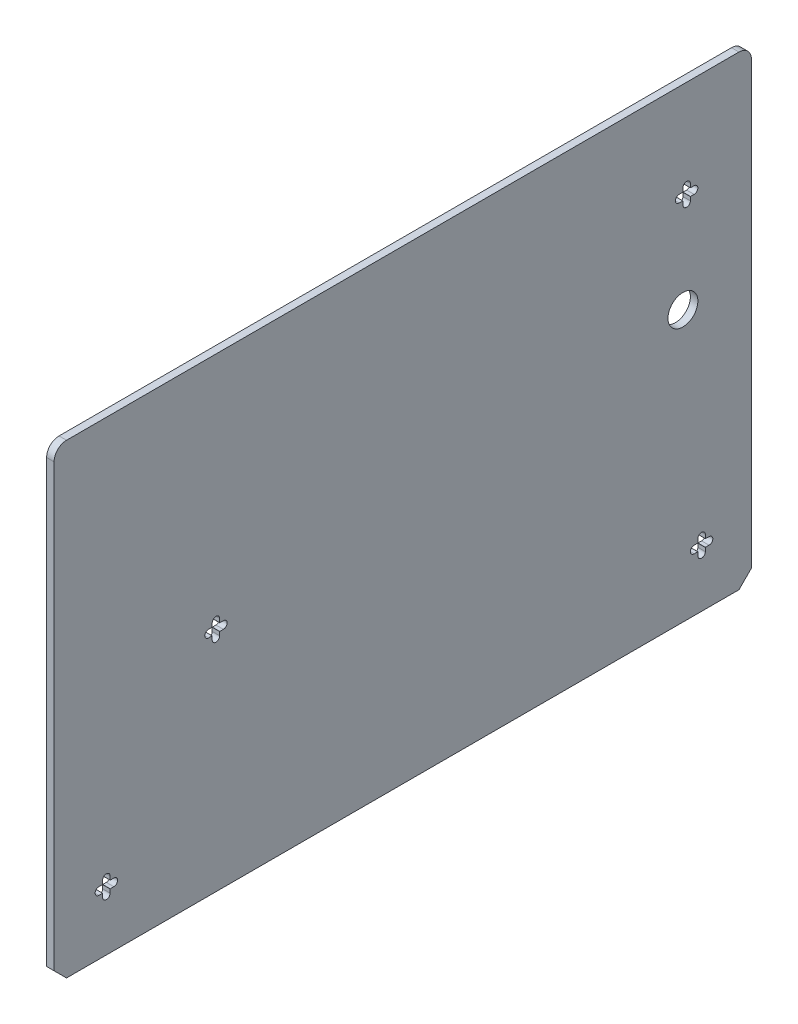
from build123d import *

# Parameters (mm, degrees)
SKETCH1_R           = 6
BOSS_EXTRUDE1_DEPTH = 3


with BuildPart() as part:
    # Sketch1 → Boss-Extrude1 (new body)
    with BuildSketch(Plane(origin=(0, 0, 0), x_dir=(0, -1, 0), z_dir=(1, 0, 0))):
        with BuildLine():
            Line((-93.5, 135), (-93.5, -135))
            ThreePointArc((-93.5, -135), (-92.035533906, -138.535533906), (-88.5, -140))
            Line((-88.5, -140), (88.5, -140))
            Line((88.5, -140), (93.5, -135))
            Line((93.5, -135), (93.5, 135))
            Line((93.5, 135), (88.5, 140))
            Line((88.5, 140), (-88.5, 140))
            ThreePointArc((-88.5, 140), (-92.035533906, 138.535533906), (-93.5, 135))
        make_face()
        with Locations(Location((-15.138013541, 112.5, 0), (0, 0, 90))):
            Circle(SKETCH1_R, mode=Mode.SUBTRACT)
        with BuildLine():
            Line((-52.95, 115.5), (-51.5, 115.5))
            ThreePointArc((-51.5, 115.5), (-50, 114), (-51.5, 112.5))
            Line((-51.5, 112.5), (-52.95, 112.5))
            ThreePointArc((-52.95, 112.5), (-52.985355339, 112.485355339), (-53, 112.45))
            Line((-53, 112.45), (-53, 111))
            ThreePointArc((-53, 111), (-54.5, 109.5), (-56, 111))
            Line((-56, 111), (-56, 112.45))
            ThreePointArc((-56, 112.45), (-56.014644661, 112.485355339), (-56.05, 112.5))
            Line((-56.05, 112.5), (-57.5, 112.5))
            ThreePointArc((-57.5, 112.5), (-59, 114), (-57.5, 115.5))
            Line((-57.5, 115.5), (-56.05, 115.5))
            ThreePointArc((-56.05, 115.5), (-56.014644661, 115.514644661), (-56, 115.55))
            Line((-56, 115.55), (-56, 117))
            ThreePointArc((-56, 117), (-54.5, 118.5), (-53, 117))
            Line((-53, 117), (-53, 115.55))
            ThreePointArc((-53, 115.55), (-52.985355339, 115.514644661), (-52.95, 115.5))
        make_face(mode=Mode.SUBTRACT)
        with BuildLine():
            Line((67.5, 121.5), (68.95, 121.5))
            ThreePointArc((68.95, 121.5), (68.985355339, 121.514644661), (69, 121.55))
            Line((69, 121.55), (69, 123))
            ThreePointArc((69, 123), (70.5, 124.5), (72, 123))
            Line((72, 123), (72, 121.55))
            ThreePointArc((72, 121.55), (72.014644661, 121.514644661), (72.05, 121.5))
            Line((72.05, 121.5), (73.5, 121.5))
            ThreePointArc((73.5, 121.5), (75, 120), (73.5, 118.5))
            Line((73.5, 118.5), (72.05, 118.5))
            ThreePointArc((72.05, 118.5), (72.014644661, 118.485355339), (72, 118.45))
            Line((72, 118.45), (72, 117))
            ThreePointArc((72, 117), (70.5, 115.5), (69, 117))
            Line((69, 117), (69, 118.45))
            ThreePointArc((69, 118.45), (68.985355339, 118.485355339), (68.95, 118.5))
            Line((68.95, 118.5), (67.5, 118.5))
            ThreePointArc((67.5, 118.5), (66, 120), (67.5, 121.5))
        make_face(mode=Mode.SUBTRACT)
        with BuildLine():
            Line((3.75, -72), (3.75, -73.45))
            ThreePointArc((3.75, -73.45), (3.764644661, -73.485355339), (3.8, -73.5))
            Line((3.8, -73.5), (5.25, -73.5))
            ThreePointArc((5.25, -73.5), (6.75, -75), (5.25, -76.5))
            Line((5.25, -76.5), (3.8, -76.5))
            ThreePointArc((3.8, -76.5), (3.764644661, -76.514644661), (3.75, -76.55))
            Line((3.75, -76.55), (3.75, -78))
            ThreePointArc((3.75, -78), (2.25, -79.5), (0.75, -78))
            Line((0.75, -78), (0.75, -76.55))
            ThreePointArc((0.75, -76.55), (0.735355339, -76.514644661), (0.7, -76.5))
            Line((0.7, -76.5), (-0.75, -76.5))
            ThreePointArc((-0.75, -76.5), (-2.25, -75), (-0.75, -73.5))
            Line((-0.75, -73.5), (0.7, -73.5))
            ThreePointArc((0.7, -73.5), (0.735355339, -73.485355339), (0.75, -73.45))
            Line((0.75, -73.45), (0.75, -72))
            ThreePointArc((0.75, -72), (2.25, -70.5), (3.75, -72))
        make_face(mode=Mode.SUBTRACT)
        with BuildLine():
            Line((71.25, -116), (71.25, -117.45))
            ThreePointArc((71.25, -117.45), (71.264644661, -117.485355339), (71.3, -117.5))
            Line((71.3, -117.5), (72.75, -117.5))
            ThreePointArc((72.75, -117.5), (74.25, -119), (72.75, -120.5))
            Line((72.75, -120.5), (71.3, -120.5))
            ThreePointArc((71.3, -120.5), (71.264644661, -120.514644661), (71.25, -120.55))
            Line((71.25, -120.55), (71.25, -122))
            ThreePointArc((71.25, -122), (69.75, -123.5), (68.25, -122))
            Line((68.25, -122), (68.25, -120.55))
            ThreePointArc((68.25, -120.55), (68.235355339, -120.514644661), (68.2, -120.5))
            Line((68.2, -120.5), (66.75, -120.5))
            ThreePointArc((66.75, -120.5), (65.25, -119), (66.75, -117.5))
            Line((66.75, -117.5), (68.2, -117.5))
            ThreePointArc((68.2, -117.5), (68.235355339, -117.485355339), (68.25, -117.45))
            Line((68.25, -117.45), (68.25, -116))
            ThreePointArc((68.25, -116), (69.75, -114.5), (71.25, -116))
        make_face(mode=Mode.SUBTRACT)
    extrude(amount=BOSS_EXTRUDE1_DEPTH)


solid = part.part
